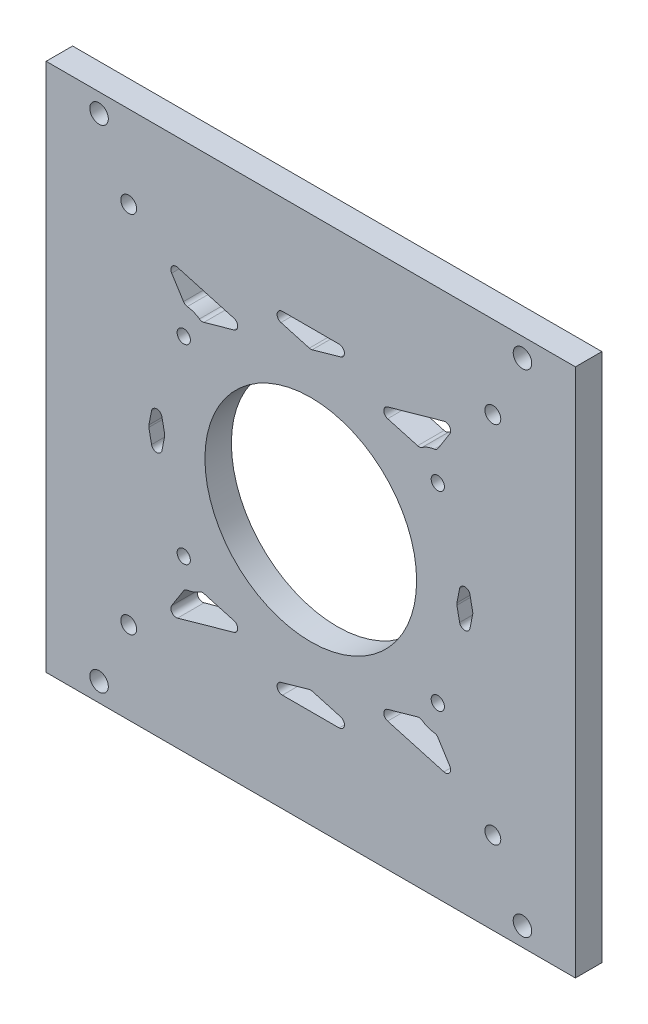
from build123d import *

# Parameters (mm, degrees)
SKETCH_1_W          = 100
SKETCH_1_H          = 100
EXTRUDE_1_DEPTH     = 5
SKETCH_2_R          = 1.75
CUT_EXTRUDE_1_DEPTH = 5
SKETCH_3_R          = 1.25
SKETCH_3_R_2        = 1.5
SKETCH_3_R_3        = 20
CUT_EXTRUDE_2_DEPTH = 5
CUT_EXTRUDE_3_DEPTH = 5
FILLET_27_R         = 1


with BuildPart() as part:
    # 草图1 → 凸台-拉伸1 (new body)
    with BuildSketch(Plane.XY):
        with Locations((50, 50)):
            Rectangle(SKETCH_1_W, SKETCH_1_H)
    extrude(amount=EXTRUDE_1_DEPTH)

    # 草图2 → 切除-拉伸1 (cut)
    with BuildSketch(Plane.XY.offset(5)):
        with Locations((10, 96.45)):
            Circle(SKETCH_2_R)
        with Locations((90, 96.45)):
            Circle(SKETCH_2_R)
        with Locations((10, 3.55)):
            Circle(SKETCH_2_R)
        with Locations((90, 3.55)):
            Circle(SKETCH_2_R)
    extrude(amount=-CUT_EXTRUDE_1_DEPTH, mode=Mode.SUBTRACT)

    # 草图3 → 切除-拉伸2 (cut)
    with BuildSketch(Plane.XY.offset(5)):
        with Locations((26, 68)):
            Circle(SKETCH_3_R)
        with Locations((74, 68)):
            Circle(SKETCH_3_R)
        with Locations((26, 32)):
            Circle(SKETCH_3_R)
        with Locations((74, 32)):
            Circle(SKETCH_3_R)
        with Locations((15.6, 84.4)):
            Circle(SKETCH_3_R_2)
        with Locations((84.4, 84.4)):
            Circle(SKETCH_3_R_2)
        with Locations((84.4, 15.6)):
            Circle(SKETCH_3_R_2)
        with Locations((15.6, 15.6)):
            Circle(SKETCH_3_R_2)
        with Locations((50, 50)):
            Circle(SKETCH_3_R_3)
    extrude(amount=-CUT_EXTRUDE_2_DEPTH, mode=Mode.SUBTRACT)

    # 草图4 → 切除-拉伸3 (cut)
    with BuildSketch(Plane.XY.offset(5)):
        Polygon((62.620906011, 81.4), (37.379093989, 81.4), (50, 77.85577297), align=None)
        with BuildLine():
            Line((38.90383284, 74.739726027), (22.326209721, 79.395085944))
            Line((22.326209721, 79.395085944), (26.226184699, 73.245125402))
            ThreePointArc((26.226184699, 73.245125402), (27.87858351, 72.902389621), (29.336878066, 72.05311544))
            Line((29.336878066, 72.05311544), (38.90383284, 74.739726027))
        make_face()
        with BuildLine():
            Line((77.673790279, 79.395085944), (61.09616716, 74.739726027))
            Line((61.09616716, 74.739726027), (70.663121934, 72.05311544))
            ThreePointArc((70.663121934, 72.05311544), (72.12141649, 72.902389621), (73.773815301, 73.245125402))
            Line((73.773815301, 73.245125402), (77.673790279, 79.395085944))
        make_face()
        Polygon((50, 22.14422703), (37.379093989, 18.6), (62.620906011, 18.6), align=None)
        with BuildLine():
            ThreePointArc((29.336878066, 27.94688456), (27.87858351, 27.097610379), (26.226184699, 26.754874598))
            Line((26.226184699, 26.754874598), (22.326209721, 20.604914056))
            Line((22.326209721, 20.604914056), (38.90383284, 25.260273973))
            Line((38.90383284, 25.260273973), (29.336878066, 27.94688456))
        make_face()
        with BuildLine():
            Line((70.663121934, 27.94688456), (61.09616716, 25.260273973))
            Line((61.09616716, 25.260273973), (77.673790279, 20.604914056))
            Line((77.673790279, 20.604914056), (73.773815301, 26.754874598))
            ThreePointArc((73.773815301, 26.754874598), (72.12141649, 27.097610379), (70.663121934, 27.94688456))
        make_face()
        Polygon((22.427480916, 50), (20.898222534, 57.70510954), (19.368964152, 50), (20.898222534, 42.29489046), align=None)
        Polygon((79.101777466, 42.29489046), (80.631035848, 50), (79.101777466, 57.70510954), (77.572519084, 50), align=None)
    extrude(amount=-CUT_EXTRUDE_3_DEPTH, mode=Mode.SUBTRACT)

    # 圆角27
    fillet_27_edges = [part.edges().sort_by_distance(p)[0] for p in [
        (29.336878066, 72.05311544, 2.5),
        (26.226184699, 73.245125402, 2.5),
        (22.326209721, 79.395085944, 2.5),
        (38.90383284, 74.739726027, 2.5),
        (73.773815301, 73.245125402, 2.5),
        (70.663121934, 72.05311544, 2.5),
        (61.09616716, 74.739726027, 2.5),
        (77.673790279, 79.395085944, 2.5),
        (26.226184699, 26.754874598, 2.5),
        (29.336878066, 27.94688456, 2.5),
        (38.90383284, 25.260273973, 2.5),
        (22.326209721, 20.604914056, 2.5),
        (50, 22.14422703, 2.5),
        (62.620906011, 18.6, 2.5),
        (37.379093989, 18.6, 2.5),
        (79.101777466, 57.70510954, 2.5),
        (80.631035848, 50, 2.5),
        (79.101777466, 42.29489046, 2.5),
        (77.572519084, 50, 2.5),
        (20.898222534, 42.29489046, 2.5),
        (19.368964152, 50, 2.5),
        (20.898222534, 57.70510954, 2.5),
        (22.427480916, 50, 2.5),
        (70.663121934, 27.94688456, 2.5),
        (73.773815301, 26.754874598, 2.5),
        (77.673790279, 20.604914056, 2.5),
        (61.09616716, 25.260273973, 2.5),
        (50, 77.85577297, 2.5),
        (37.379093989, 81.4, 2.5),
        (62.620906011, 81.4, 2.5),
    ]]
    fillet(fillet_27_edges, radius=FILLET_27_R)


solid = part.part
